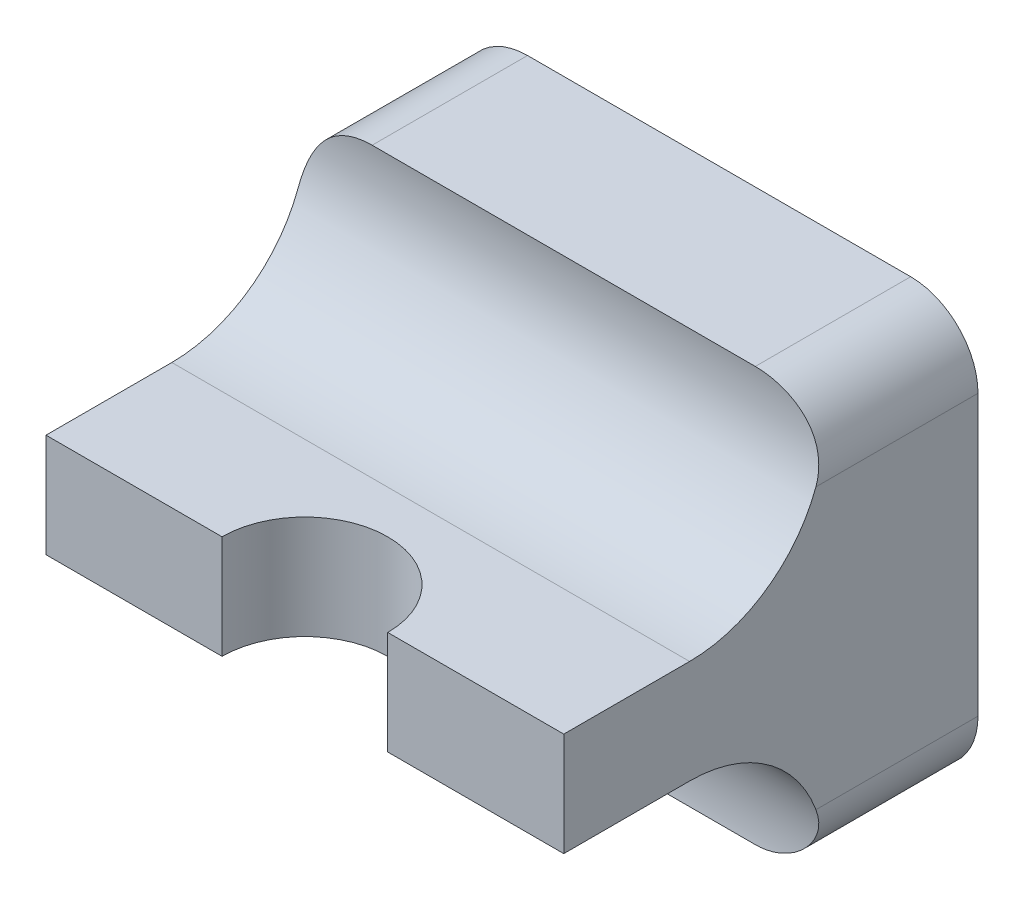
from build123d import *

# Parameters (mm, degrees)
BOSS_EXTRUDE3_DEPTH = 40
CUT_EXTRUDE1_DEPTH  = 73.265136823
CUT_EXTRUDE2_DEPTH  = 10


with BuildPart() as part:
    # Sketch1 → Boss-Extrude3 (new body)
    with BuildSketch(Plane.XY):
        with BuildLine():
            Line((-37, -6.5), (0, -6.5))
            ThreePointArc((0, -6.5), (4.596194078, -4.596194078), (6.5, 0))
            Line((6.5, 0), (6.5, 27))
            ThreePointArc((6.5, 27), (4.596194078, 31.596194078), (0, 33.5))
            Line((0, 33.5), (-37, 33.5))
            ThreePointArc((-37, 33.5), (-41.596194078, 31.596194078), (-43.5, 27))
            Line((-43.5, 27), (-43.5, 0))
            ThreePointArc((-43.5, 0), (-41.596194078, -4.596194078), (-37, -6.5))
        make_face()
    extrude(amount=BOSS_EXTRUDE3_DEPTH)

    # Sketch3 → Cut-Extrude1 (cut, through all)
    with BuildSketch(Plane(origin=(6.5, 0, 0), x_dir=(0, 0, -1), z_dir=(1, 0, 0))):
        with BuildLine():
            Line((-27.850101272, 18.5), (-40, 18.5))
            Line((-40, 18.5), (-40, 33.5))
            Line((-40, 33.5), (-15.004868693, 33.5))
            ThreePointArc((-15.004868693, 33.5), (-17.975892442, 23.044232737), (-27.850101272, 18.5))
        make_face()
        with BuildLine():
            Line((-40, 8.5), (-40, -6.5))
            Line((-40, -6.5), (-15, -6.5))
            ThreePointArc((-15, -6.5), (-17.97102375, 3.955767263), (-27.845232579, 8.5))
            Line((-27.845232579, 8.5), (-40, 8.5))
        make_face()
    extrude(amount=-CUT_EXTRUDE1_DEPTH, mode=Mode.SUBTRACT)

    # Sketch4 → Cut-Extrude2 (cut)
    with BuildSketch(Plane(origin=(0, 18.5, 0), x_dir=(1, 0, 0), z_dir=(0, 1, 0))):
        with BuildLine():
            Line((-10.5, -40), (-26.5, -40))
            ThreePointArc((-26.5, -40), (-18.5, -32), (-10.5, -40))
        make_face()
    extrude(amount=-CUT_EXTRUDE2_DEPTH, mode=Mode.SUBTRACT)


solid = part.part
